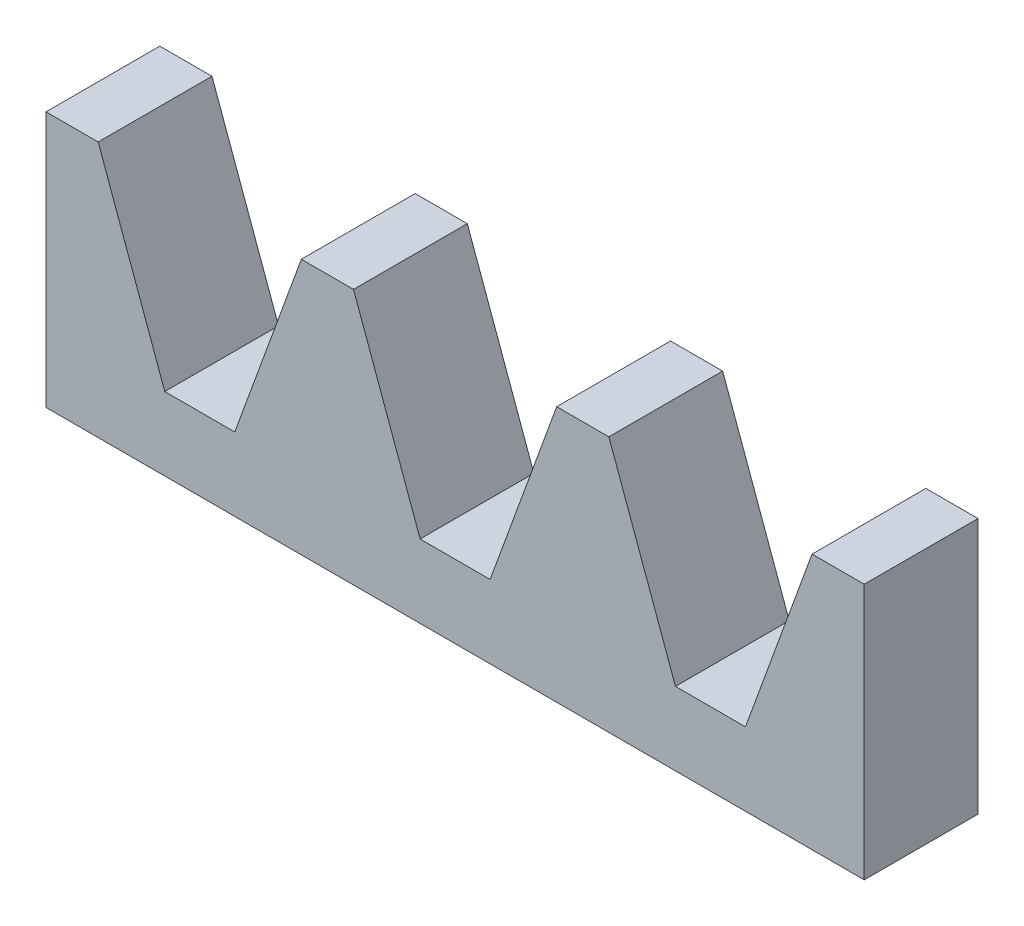
from build123d import *

# Parameters (mm, degrees)
BLANKSKE_W          = 24
BLANKSKE_H          = 6.3
BLANK_DEPTH         = 2.8
TOOTHCUTSIM_DEPTH   = 25.970582692
TEETHCUTS_COUNT     = 5
TEETHCUTS_PITCH     = 6.2831853
SKETCH_1_W          = 1.366995594
SKETCH_1_H          = 6.3
SKETCH_1_W_2        = 2.499736794
CUT_EXTRUDE_1_DEPTH = 25.970582692


with BuildPart() as part:
    # BlankSke → Blank (new body)
    with BuildSketch(Plane.XY):
        with Locations((12, 3.15)):
            Rectangle(BLANKSKE_W, BLANKSKE_H)
    extrude(amount=-BLANK_DEPTH)

    # TooCutSkeSim → ToothCutSim (cut, through all)
    with BuildSketch(Plane.XY):
        Polygon((0.861870739, 1.8), (-0.861870739, 1.8), (-2.508981637, 6.3254), (2.508981637, 6.3254), align=None)
    toothcutsim = extrude(amount=-TOOTHCUTSIM_DEPTH, mode=Mode.SUBTRACT)

    # TeethCuts: ToothCutSim ×5
    with Locations(*[(i * TEETHCUTS_PITCH, 0, 0) for i in range(1, TEETHCUTS_COUNT)]):
        add(toothcutsim, mode=Mode.SUBTRACT)

    # ｽｹｯﾁ1 → ｶｯﾄ - 押し出し1 (cut, through all)
    with BuildSketch(Plane.XY):
        with Locations((23.316502203, 3.15)):
            Rectangle(SKETCH_1_W, SKETCH_1_H)
        with Locations((1.249868397, 3.15)):
            Rectangle(SKETCH_1_W_2, SKETCH_1_H)
    extrude(amount=-CUT_EXTRUDE_1_DEPTH, mode=Mode.SUBTRACT)


solid = part.part
